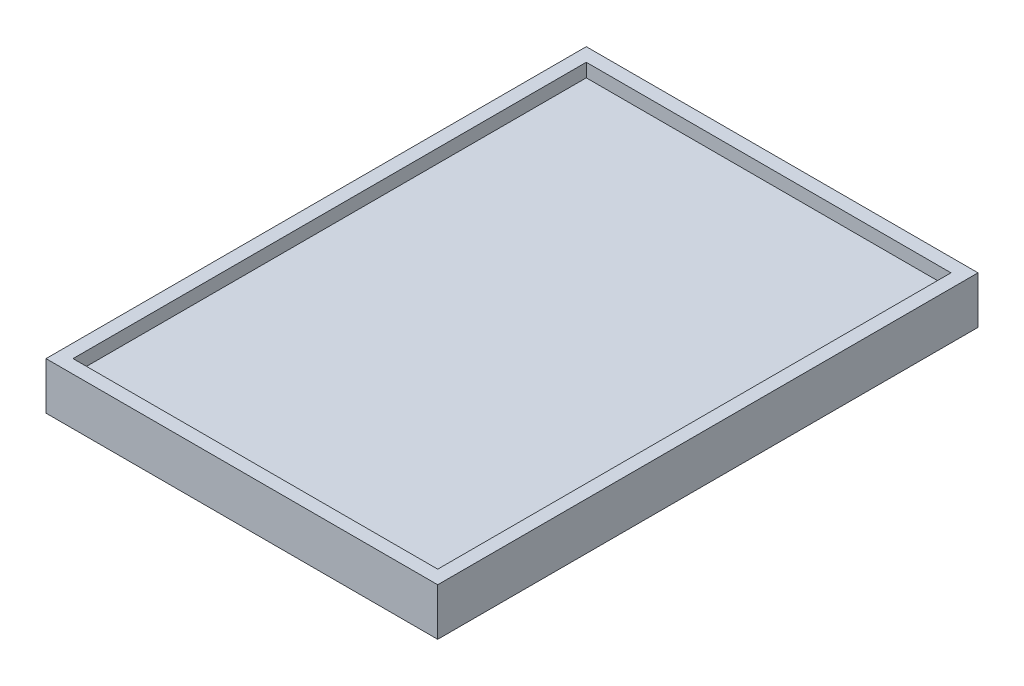
from build123d import *

# Parameters (mm, degrees)
SKETCH1_W           = 290
SKETCH1_H           = 400
BOSS_EXTRUDE1_DEPTH = 35
SKETCH2_W           = 270
SKETCH2_H           = 380
CUT_EXTRUDE2_DEPTH  = 10


with BuildPart() as part:
    # Sketch1 → Boss-Extrude1 (new body)
    with BuildSketch(Plane(origin=(0, 0, 0), x_dir=(1, 0, 0), z_dir=(0, 1, 0))):
        Rectangle(SKETCH1_W, SKETCH1_H)
    extrude(amount=BOSS_EXTRUDE1_DEPTH)

    # Sketch2 → Cut-Extrude2 (cut)
    with BuildSketch(Plane(origin=(0, 35, 0), x_dir=(1, 0, 0), z_dir=(0, 1, 0))):
        Rectangle(SKETCH2_W, SKETCH2_H)
    extrude(amount=-CUT_EXTRUDE2_DEPTH, mode=Mode.SUBTRACT)


solid = part.part
